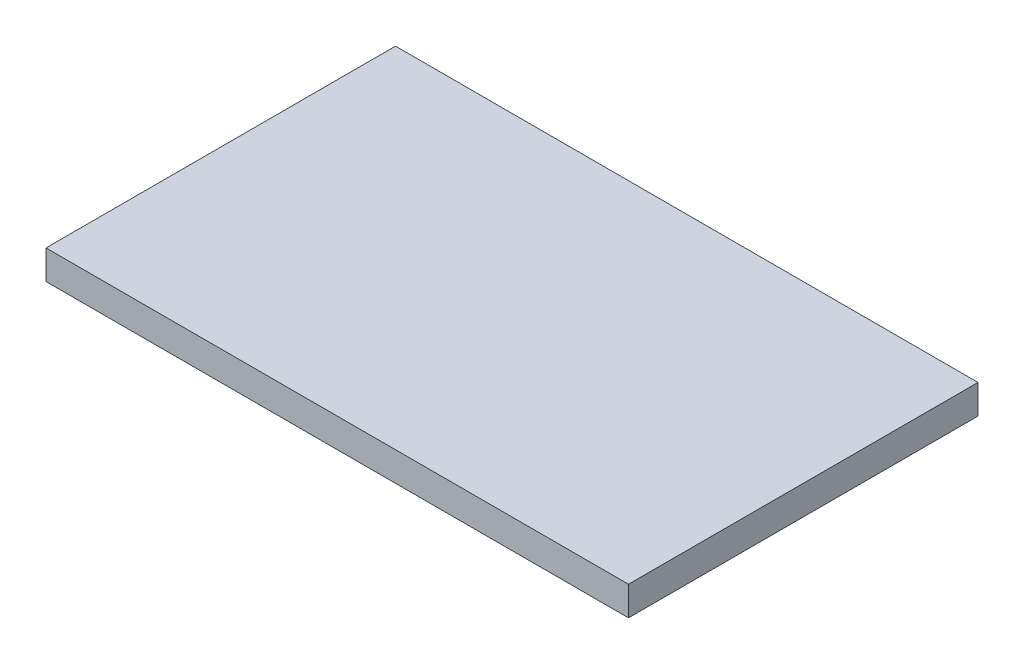
from build123d import *

# Parameters (mm, degrees)
SKETCH2_W           = 200
SKETCH2_H           = 120
BOSS_EXTRUDE1_DEPTH = 10


with BuildPart() as part:
    # Sketch2 → Boss-Extrude1 (new body)
    with BuildSketch(Plane(origin=(0, 0, 0), x_dir=(1, 0, 0), z_dir=(0, 1, 0))):
        with Locations((100, 60)):
            Rectangle(SKETCH2_W, SKETCH2_H)
    extrude(amount=BOSS_EXTRUDE1_DEPTH)


solid = part.part
